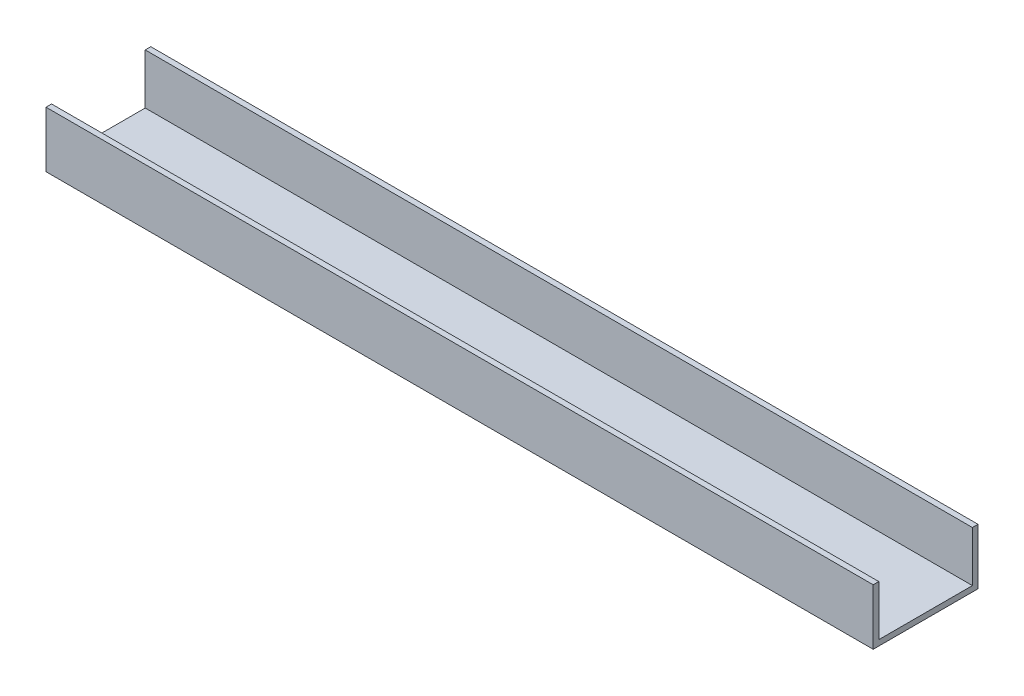
from build123d import *

# Parameters (mm, degrees)
SKETCH_3_W      = 592
SKETCH_3_H      = 75
EXTRUDE_2_DEPTH = 4
SKETCH_4_W      = 592
SKETCH_4_H      = 4
EXTRUDE_3_DEPTH = 36


with BuildPart() as part:
    # 스케치3 → 보스-돌출2 (new body)
    with BuildSketch(Plane(origin=(0, 0, 0), x_dir=(1, 0, 0), z_dir=(0, 1, 0))):
        with Locations((296, 37.5)):
            Rectangle(SKETCH_3_W, SKETCH_3_H)
    extrude(amount=EXTRUDE_2_DEPTH)

    # 스케치4 → 보스-돌출3 (add)
    with BuildSketch(Plane(origin=(0, 4, 0), x_dir=(1, 0, 0), z_dir=(0, 1, 0))):
        with Locations((296, 2)):
            Rectangle(SKETCH_4_W, SKETCH_4_H)
        with Locations((296, 73)):
            Rectangle(SKETCH_4_W, SKETCH_4_H)
    extrude(amount=EXTRUDE_3_DEPTH)


solid = part.part
